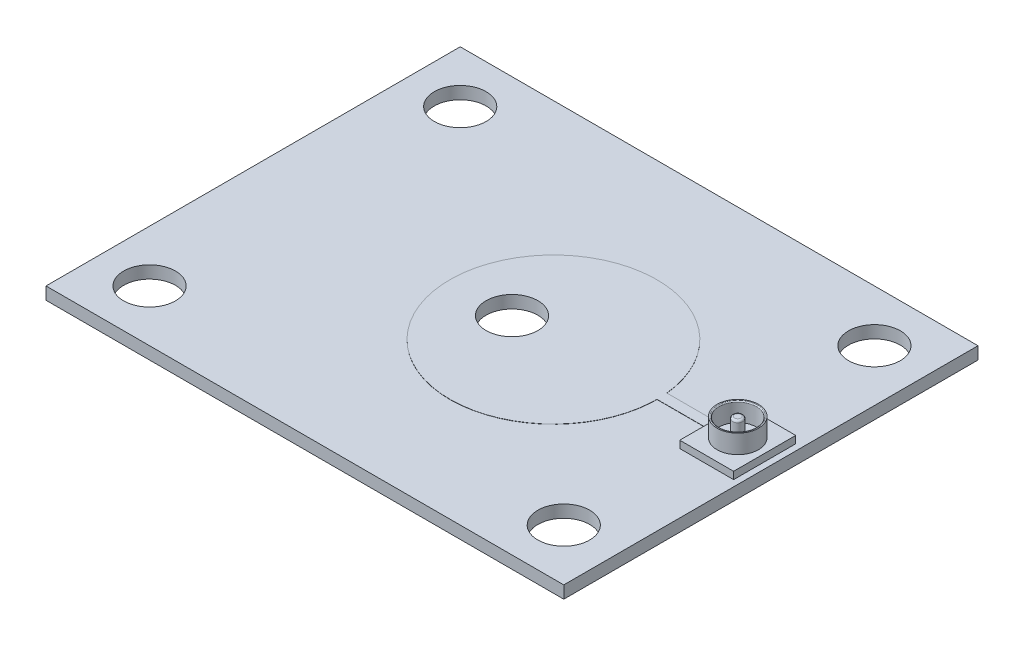
from build123d import *

# Parameters (mm, degrees)
SKETCH1_W           = 25
SKETCH1_H           = 20
BOSS_EXTRUDE1_DEPTH = 0.6
SKETCH2_R           = 1.25
CUT_EXTRUDE1_DEPTH  = 0.6
SKETCH4_W           = 2.6
SKETCH4_H           = 3
BOSS_EXTRUDE2_DEPTH = 0.35
SKETCH5_R           = 1
BOSS_EXTRUDE3_DEPTH = 0.9
SKETCH6_R           = 0.9
SKETCH6_R_2         = 0.25
CUT_EXTRUDE2_DEPTH  = 0.9
FILLET1_R           = 0.1
FILLET2_R           = 0.05
BOSS_EXTRUDE9_START = 0.01
SKETCH8_R           = 1.25
BOSS_EXTRUDE9_DEPTH = 0.01


with BuildPart() as part:
    # Sketch1 → Boss-Extrude1 (new body)
    with BuildSketch(Plane(origin=(0, 0, 0), x_dir=(1, 0, 0), z_dir=(0, 1, 0))):
        Rectangle(SKETCH1_W, SKETCH1_H)
    extrude(amount=BOSS_EXTRUDE1_DEPTH)

    # Sketch2 → Cut-Extrude1 (cut)
    with BuildSketch(Plane(origin=(0, 0.6, 0), x_dir=(1, 0, 0), z_dir=(0, 1, 0))):
        with Locations(Location((-10, 7.5, 0), (0, 0, 270))):
            Circle(SKETCH2_R)
        with Locations(Location((10, 7.5, 0), (0, 0, 90))):
            Circle(SKETCH2_R)
        with Locations(Location((10, -7.5, 0), (0, 0, 270))):
            Circle(SKETCH2_R)
        with Locations(Location((-10, -7.5, 0), (0, 0, 90))):
            Circle(SKETCH2_R)
        with Locations(Location((0, 0, 0), (0, 0, 270))):
            Circle(SKETCH2_R)
    extrude(amount=-CUT_EXTRUDE1_DEPTH, mode=Mode.SUBTRACT)

    # Sketch4 → Boss-Extrude2 (add)
    with BuildSketch(Plane(origin=(0, 0.6, 0), x_dir=(1, 0, 0), z_dir=(0, 1, 0))):
        with Locations((10.9, 0)):
            Rectangle(SKETCH4_W, SKETCH4_H)
    extrude(amount=BOSS_EXTRUDE2_DEPTH)

    # Sketch5 → Boss-Extrude3 (add)
    with BuildSketch(Plane(origin=(0, 0.95, 0), x_dir=(1, 0, 0), z_dir=(0, 1, 0))):
        with Locations(Location((10.9, 0, 0), (0, 0, 270))):
            Circle(SKETCH5_R)
    extrude(amount=BOSS_EXTRUDE3_DEPTH)

    # Sketch6 → Cut-Extrude2 (cut)
    with BuildSketch(Plane(origin=(0, 1.85, 0), x_dir=(1, 0, 0), z_dir=(0, 1, 0))):
        with Locations(Location((10.9, 0, 0), (0, 0, 270))):
            Circle(SKETCH6_R)
        with Locations(Location((10.9, 0, 0), (0, 0, 270))):
            Circle(SKETCH6_R_2, mode=Mode.SUBTRACT)
    extrude(amount=-CUT_EXTRUDE2_DEPTH, mode=Mode.SUBTRACT)

    # Fillet1
    fillet1_edges = [part.edges().sort_by_distance(p)[0] for p in [
        (10.9, 1.85, -0.25),
    ]]
    fillet(fillet1_edges, radius=FILLET1_R)

    # Fillet2
    fillet2_edges = [part.edges().sort_by_distance(p)[0] for p in [
        (10.9, 1.85, -0.9),
    ]]
    fillet(fillet2_edges, radius=FILLET2_R)

    # Sketch8 → Boss-Extrude9 (add)
    # profile 1 of 3: a face of its own
    with BuildSketch(Plane(origin=(0, 0.6, 0), x_dir=(1, 0, 0), z_dir=(0, 1, 0)).offset(BOSS_EXTRUDE9_START)):
        with BuildLine():
            Line((6.991, -0.29986497), (7, 0))
            Line((7, 0), (1.25, 0))
            Line((1.25, 0), (1.25, 0.5))
            Line((1.25, 0.5), (6.974937186, 0.5))
            ThreePointArc((6.974937186, 0.5), (-2.998992097, -0.100389298), (6.991, -0.29986497))
        make_face()
        with Locations(Location((0, 0, 0), (0, 0, 270))):
            Circle(SKETCH8_R, mode=Mode.SUBTRACT)
    # profile 2 of 3: a face of its own
    with BuildSketch(Plane(origin=(0, 0.6, 0), x_dir=(1, 0, 0), z_dir=(0, 1, 0)).offset(BOSS_EXTRUDE9_START)):
        with BuildLine():
            Line((1.25, 0), (7, 0))
            ThreePointArc((7, 0), (6.993730366, 0.250313875), (6.974937186, 0.5))
            Line((6.974937186, 0.5), (1.25, 0.5))
            Line((1.25, 0.5), (1.25, 0))
        make_face()
    # profile 3 of 3: a face of its own
    with BuildSketch(Plane(origin=(0, 0.6, 0), x_dir=(1, 0, 0), z_dir=(0, 1, 0)).offset(BOSS_EXTRUDE9_START)):
        with BuildLine():
            ThreePointArc((6.974937186, 0.5), (6.993730366, 0.250313875), (7, 0))
            Line((7, 0), (9.6, 0))
            Line((9.6, 0), (9.6, 0.5))
            Line((9.6, 0.5), (6.974937186, 0.5))
        make_face()
    extrude(amount=-BOSS_EXTRUDE9_DEPTH)


solid = part.part
